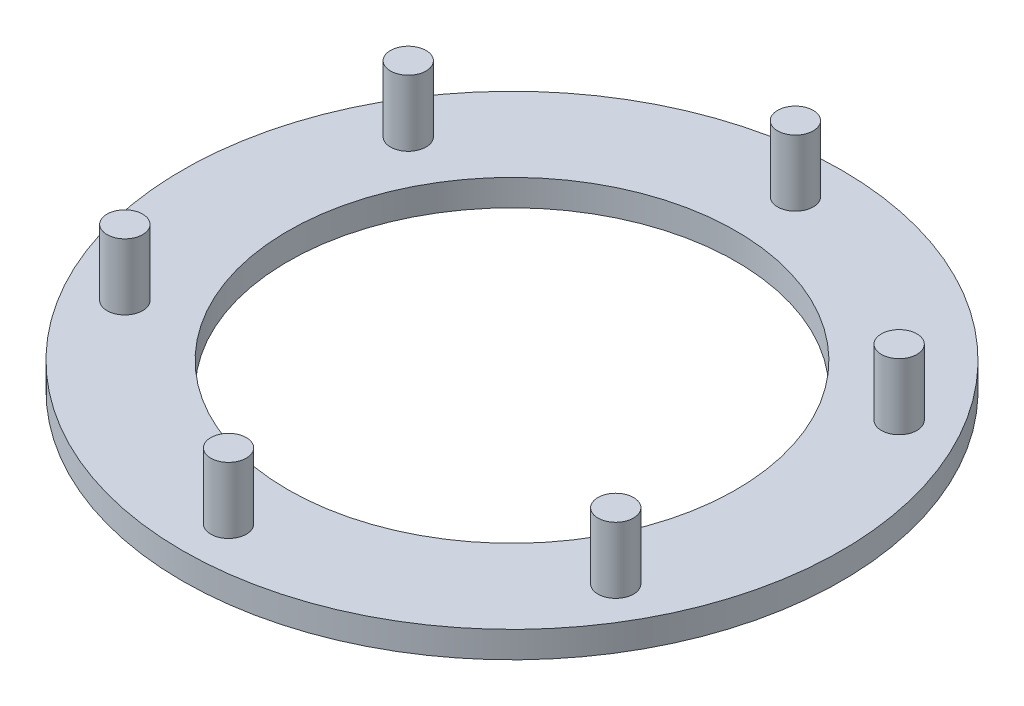
from build123d import *

# Parameters (mm, degrees)
SKETCH1_R           = 25
SKETCH1_R_2         = 1.35
SKETCH1_R_3         = 17
BOSS_EXTRUDE1_DEPTH = 2
SKETCH1_3_R         = 1.35
BOSS_EXTRUDE2_DEPTH = 7


with BuildPart() as part:
    # Sketch1 → Boss-Extrude1 (new body)
    with BuildSketch(Plane(origin=(0, 0, 0), x_dir=(1, 0, 0), z_dir=(0, 1, 0))):
        Circle(SKETCH1_R)
        with Locations((0, 21.5)):
            Circle(SKETCH1_R_2, mode=Mode.SUBTRACT)
        with Locations((18.619546181, 10.75)):
            Circle(SKETCH1_R_2, mode=Mode.SUBTRACT)
        with Locations((18.619546181, -10.75)):
            Circle(SKETCH1_R_2, mode=Mode.SUBTRACT)
        with Locations((0, -21.5)):
            Circle(SKETCH1_R_2, mode=Mode.SUBTRACT)
        with Locations((-18.619546181, -10.75)):
            Circle(SKETCH1_R_2, mode=Mode.SUBTRACT)
        with Locations((-18.619546181, 10.75)):
            Circle(SKETCH1_R_2, mode=Mode.SUBTRACT)
        Circle(SKETCH1_R_3, mode=Mode.SUBTRACT)
    extrude(amount=BOSS_EXTRUDE1_DEPTH)

    # Sketch1<3> → Boss-Extrude2 (add)
    with BuildSketch(Plane(origin=(0, 0, 0), x_dir=(1, 0, 0), z_dir=(0, 1, 0))):
        with Locations((0, 21.5)):
            Circle(SKETCH1_3_R)
        with Locations((18.619546181, 10.75)):
            Circle(SKETCH1_3_R)
        with Locations((18.619546181, -10.75)):
            Circle(SKETCH1_3_R)
        with Locations((0, -21.5)):
            Circle(SKETCH1_3_R)
        with Locations((-18.619546181, -10.75)):
            Circle(SKETCH1_3_R)
        with Locations((-18.619546181, 10.75)):
            Circle(SKETCH1_3_R)
    extrude(amount=BOSS_EXTRUDE2_DEPTH)


solid = part.part
